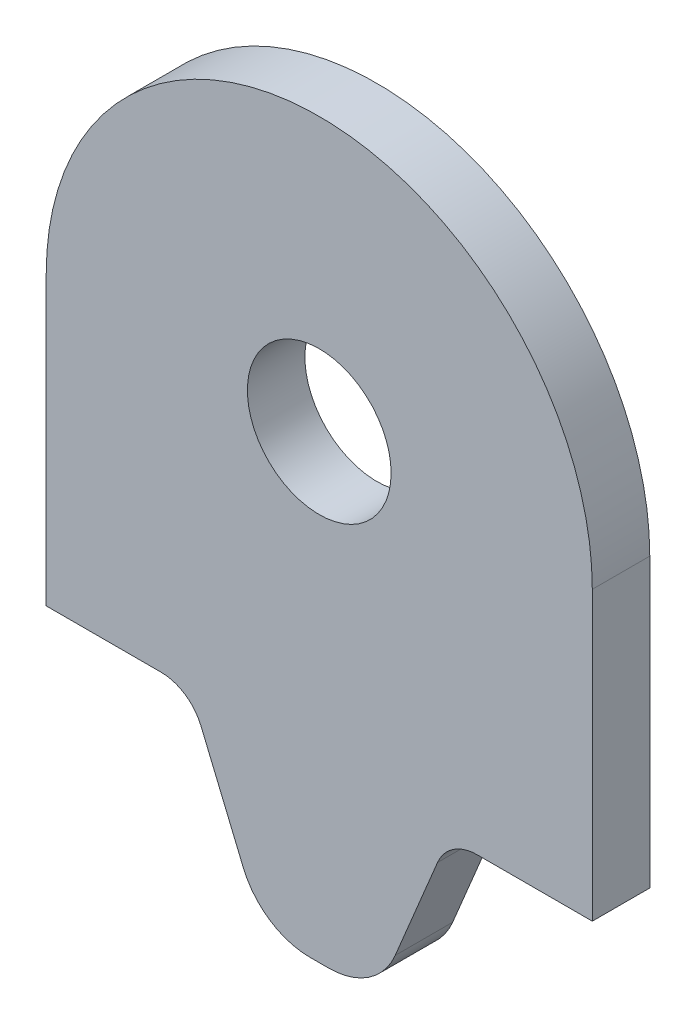
from build123d import *

# Parameters (mm, degrees)
SKETCH1_R           = 2.5
SKETCH1_R_2         = 1.5
BOSS_EXTRUDE1_DEPTH = 4
SKETCH2_R           = 5
CUT_EXTRUDE1_DEPTH  = 50.010203019
FILLET1_R           = 5
FILLET2_R           = 3


with BuildPart() as part:
    # Sketch1 → Boss-Extrude1 (new body)
    with BuildSketch(Plane.XY):
        with BuildLine():
            Line((-19, 0), (-19, -32))
            Line((-19, -32), (-14.8, -32))
            Line((-14.8, -32), (-14.8, -45))
            Line((-14.8, -45), (-5, -45))
            Line((-5, -45), (-5, -42))
            Line((-5, -42), (5, -42))
            Line((5, -42), (5, -45))
            Line((5, -45), (19, -45))
            Line((19, -45), (19, 0))
            ThreePointArc((19, 0), (0, 19), (-19, 0))
        make_face()
        Circle(SKETCH1_R, mode=Mode.SUBTRACT)
        with Locations((-14, -27)):
            Circle(SKETCH1_R_2, mode=Mode.SUBTRACT)
        with Locations(Location((14, -27, 0), (0, 0, 180))):
            Circle(SKETCH1_R_2, mode=Mode.SUBTRACT)
    extrude(amount=BOSS_EXTRUDE1_DEPTH)

    # Sketch2 → Cut-Extrude1 (cut, through all)
    with BuildSketch(Plane.XY.offset(4)):
        Circle(SKETCH2_R)
        Polygon((-19, -20), (-9, -20), (-4, -32), (4, -32), (9, -20), (19, -20), (19, -45), (-19, -45), align=None)
    extrude(amount=-CUT_EXTRUDE1_DEPTH, mode=Mode.SUBTRACT)

    # Fillet1
    fillet1_edges = [part.edges().sort_by_distance(p)[0] for p in [
        (-4, -32, 2),
        (4, -32, 2),
    ]]
    fillet(fillet1_edges, radius=FILLET1_R)

    # Fillet2
    fillet2_edges = [part.edges().sort_by_distance(p)[0] for p in [
        (-9, -20, 2),
        (9, -20, 2),
    ]]
    fillet(fillet2_edges, radius=FILLET2_R)


solid = part.part
